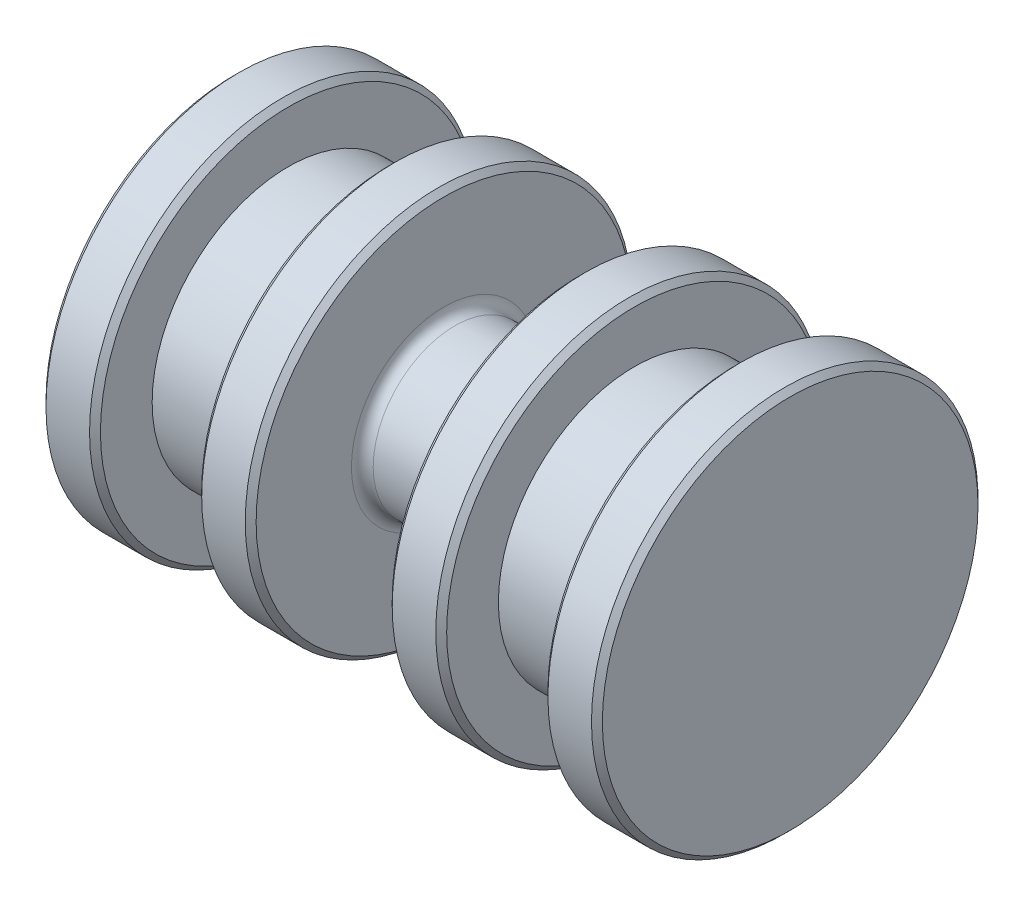
from build123d import *

# Parameters (mm, degrees)
VENT_EDGE_BREAK_SIZE = 0.127
FILLET1_R            = 0.254


with BuildPart() as part:
    # Sketch2 → Revolve1 (revolve)
    with BuildSketch(Plane.XY, mode=Mode.PRIVATE) as revolve1_sk:
        Polygon((3.6322, 4.5085), (3.6322, 3.175), (1.27, 3.175), (1.27, 4.5085), (0, 4.5085), (0, 0), (12.9794, 0), (12.9794, 4.5085), (11.7094, 4.5085), (11.7094, 3.175), (9.3472, 3.175), (9.3472, 4.5085), (8.0772, 4.5085), (8.0772, 1.905), (4.9022, 1.905), (4.9022, 4.5085), align=None)
    revolve(revolve1_sk.sketch.rotate(Axis((-1.617419624, 0, 0), (1, 0, 0)), 90), axis=Axis((-1.617419624, 0, 0), (1, 0, 0)))

    # vent-edge-break
    vent_edge_break_edges = [part.edges().sort_by_distance(p)[0] for p in [
        (1.27, 0, -4.5085),
        (3.6322, 0, -4.5085),
        (4.9022, 0, -4.5085),
        (8.0772, 0, -4.5085),
        (9.3472, 0, -4.5085),
        (11.7094, 0, -4.5085),
        (12.9794, 0, -4.5085),
        (0, 0, -4.5085),
    ]]
    chamfer(vent_edge_break_edges, length=VENT_EDGE_BREAK_SIZE)

    # Fillet1
    fillet1_edges = [part.edges().sort_by_distance(p)[0] for p in [
        (4.9022, 0, -1.905),
        (8.0772, 0, -1.905),
    ]]
    fillet(fillet1_edges, radius=FILLET1_R)


solid = part.part
